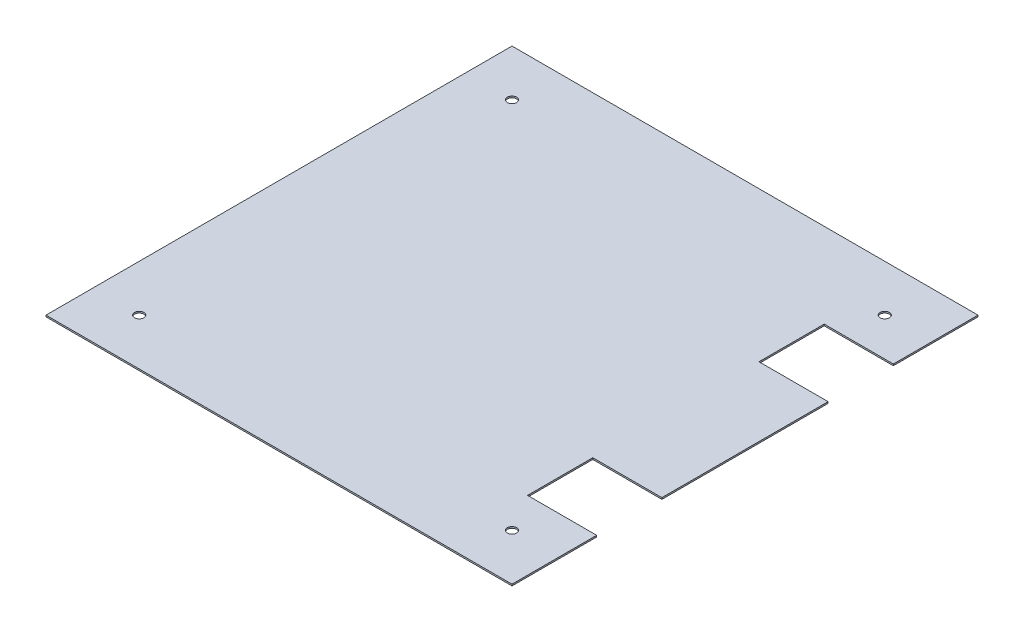
from build123d import *

# Parameters (mm, degrees)
SKETCH_1_W          = 300
SKETCH_1_H          = 300
EXTRUDE_1_DEPTH     = 1
SKETCH_2_R          = 3
CUT_EXTRUDE_2_DEPTH = 374.714004721
SKETCH_3_W          = 44.5
SKETCH_3_H          = 42
CUT_EXTRUDE_4_DEPTH = 374.714004721


with BuildPart() as part:
    # 草图1 → 凸台-拉伸1 (new body)
    with BuildSketch(Plane(origin=(0, 0, 0), x_dir=(1, 0, 0), z_dir=(0, 1, 0))):
        with Locations((93.243141409, -133.714524624)):
            Rectangle(SKETCH_1_W, SKETCH_1_H)
    extrude(amount=EXTRUDE_1_DEPTH)

    # 草图2 → 切除-拉伸2 (cut, through all)
    with BuildSketch(Plane(origin=(0, 0, 0), x_dir=(1, 0, 0), z_dir=(0, 1, 0))):
        with Locations(Location((-26.756858591, -13.714524624, 0), (0, 0, 270))):
            Circle(SKETCH_2_R)
        with Locations(Location((213.243141409, -13.714524624, 0), (0, 0, 270))):
            Circle(SKETCH_2_R)
        with Locations(Location((213.243141409, -253.714524624, 0), (0, 0, 270))):
            Circle(SKETCH_2_R)
        with Locations(Location((-26.756858591, -253.714524624, 0), (0, 0, 270))):
            Circle(SKETCH_2_R)
    extrude(amount=CUT_EXTRUDE_2_DEPTH, mode=Mode.SUBTRACT)

    # 草图3 → 切除-拉伸4 (cut, through all)
    with BuildSketch(Plane(origin=(0, 0, 0), x_dir=(1, 0, 0), z_dir=(0, 1, 0))):
        with Locations((220.993141409, -208.214524624)):
            Rectangle(SKETCH_3_W, SKETCH_3_H)
        with Locations((220.993141409, -59.214524624)):
            Rectangle(SKETCH_3_W, SKETCH_3_H)
    extrude(amount=CUT_EXTRUDE_4_DEPTH, mode=Mode.SUBTRACT)


solid = part.part
